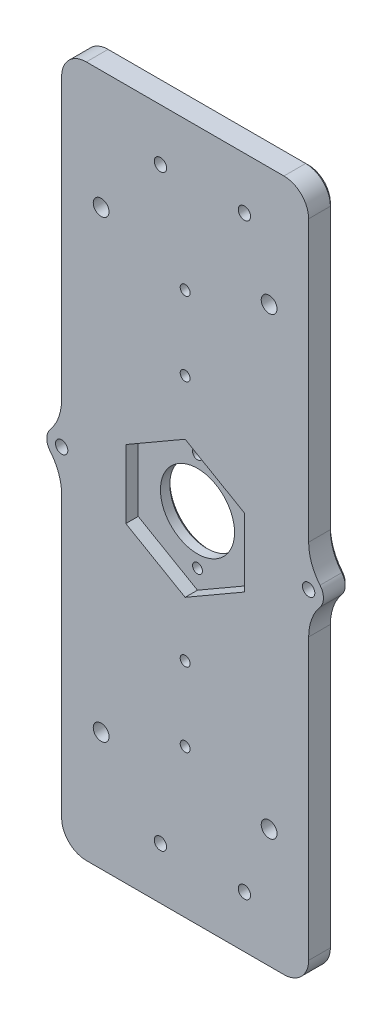
from build123d import *

# Parameters (mm, degrees)
SKETCH_1_W          = 50
SKETCH_1_H          = 140
EXTRUDE_1_DEPTH     = 5
SKETCH_16_R         = 3
EXTRUDE_2_DEPTH     = 5
CUT_EXTRUDE_5_DEPTH = 2.5
SKETCH_12_R         = 7.5
CUT_EXTRUDE_6_DEPTH = 2.5
SKETCH_13_R         = 1.25
CUT_EXTRUDE_7_DEPTH = 76.557924799
FILLET_2_R          = 10
FILLET_1_R          = 5
SKETCH_14_R         = 1
SKETCH_14_R_2       = 1.6
SKETCH_14_R_3       = 1.25
CUT_EXTRUDE_8_DEPTH = 76.557924799
CHAMFER_1_SIZE      = 0.6


with BuildPart() as part:
    # 草图1 → 凸台-拉伸1 (new body)
    with BuildSketch(Plane.XY):
        Rectangle(SKETCH_1_W, SKETCH_1_H)
    extrude(amount=EXTRUDE_1_DEPTH)

    # 草图16 → 凸台-拉伸2 (add)
    with BuildSketch(Plane.XY.offset(5)):
        with Locations((25, 0)):
            Circle(SKETCH_16_R)
        with Locations((-25, 0)):
            Circle(SKETCH_16_R)
    extrude(amount=-EXTRUDE_2_DEPTH)

    # 草图11 → 切除-拉伸5 (cut)
    with BuildSketch(Plane.XY.offset(5)):
        Polygon((0, 13.856406461), (-12, 6.92820323), (-12, -6.92820323), (0, -13.856406461), (12, -6.92820323), (12, 6.92820323), align=None)
    extrude(amount=-CUT_EXTRUDE_5_DEPTH, mode=Mode.SUBTRACT)

    # 草图12 → 切除-拉伸6 (cut)
    with BuildSketch(Plane.XY.offset(2.5)):
        Circle(SKETCH_12_R)
    extrude(amount=-CUT_EXTRUDE_6_DEPTH, mode=Mode.SUBTRACT)

    # 草图13 → 切除-拉伸7 (cut, through all)
    with BuildSketch(Plane.XY.offset(5)):
        with Locations((25, 0)):
            Circle(SKETCH_13_R)
        with Locations(Location((-25, 0, 0), (0, 0, 180))):
            Circle(SKETCH_13_R)
    extrude(amount=-CUT_EXTRUDE_7_DEPTH, mode=Mode.SUBTRACT)

    # 圆角2
    fillet_2_edges = [part.edges().sort_by_distance(p)[0] for p in [
        (25, -3, 2.5),
        (25, 3, 2.5),
        (-25, 3, 2.5),
        (-25, -3, 2.5),
    ]]
    fillet(fillet_2_edges, radius=FILLET_2_R)

    # 圆角1
    fillet_1_edges = [part.edges().sort_by_distance(p)[0] for p in [
        (25, -70, 2.5),
        (-25, -70, 2.5),
        (-25, 70, 2.5),
        (25, 70, 2.5),
    ]]
    fillet(fillet_1_edges, radius=FILLET_1_R)

    # 草图14 → 切除-拉伸8 (cut, through all)
    with BuildSketch(Plane.XY.offset(5)):
        with Locations((0, 10)):
            Circle(SKETCH_14_R)
        with Locations((0, 25)):
            Circle(SKETCH_14_R)
        with Locations((0, 40)):
            Circle(SKETCH_14_R)
        with Locations((17, 46)):
            Circle(SKETCH_14_R_2)
        with Locations(Location((-17, 46, 0), (0, 0, 180))):
            Circle(SKETCH_14_R_2)
        with Locations((-5, 59.5)):
            Circle(SKETCH_14_R_3)
        with Locations((12, 59.5)):
            Circle(SKETCH_14_R_3)
    cut_extrude_8 = extrude(amount=-CUT_EXTRUDE_8_DEPTH, mode=Mode.SUBTRACT)

    # 镜向1: 切除-拉伸8 across plane
    add(cut_extrude_8.mirror(Plane.ZX), mode=Mode.SUBTRACT)

    # 倒角1
    chamfer_1_edges = [part.edges().sort_by_distance(p)[0] for p in [
        (25, -36.653311931, 0),
        (0, -70, 0),
        (23.535533906, 68.535533906, 0),
        (23.535533906, -68.535533906, 0),
        (-23.535533906, -68.535533906, 0),
        (-23.535533906, 68.535533906, 0),
        (-1, 10, 0),
        (-15.4, 46, 0),
        (-1, 40, 0),
        (-1, 25, 0),
        (15.4, 46, 0),
        (-6.25, 59.5, 0),
        (10.75, 59.5, 0),
        (-1, -10, 0),
        (-15.4, -46, 0),
        (-1, -40, 0),
        (-1, -25, 0),
        (15.4, -46, 0),
        (-6.25, -59.5, 0),
        (10.75, -59.5, 0),
        (-7.5, 0, 0),
        (23.75, 0, 0),
        (-23.75, 0, 0),
        (-25, -36.653311931, 0),
        (-28, 0, 0),
        (28, 0, 0),
        (25, 36.653311931, 0),
        (-25.594600569, -4.90979276, 0),
        (-25.594600569, 4.90979276, 0),
        (25.594600569, -4.90979276, 0),
        (25.594600569, 4.90979276, 0),
        (-25, 36.653311931, 0),
        (0, 70, 0),
    ]]
    chamfer(chamfer_1_edges, length=CHAMFER_1_SIZE)


solid = part.part
